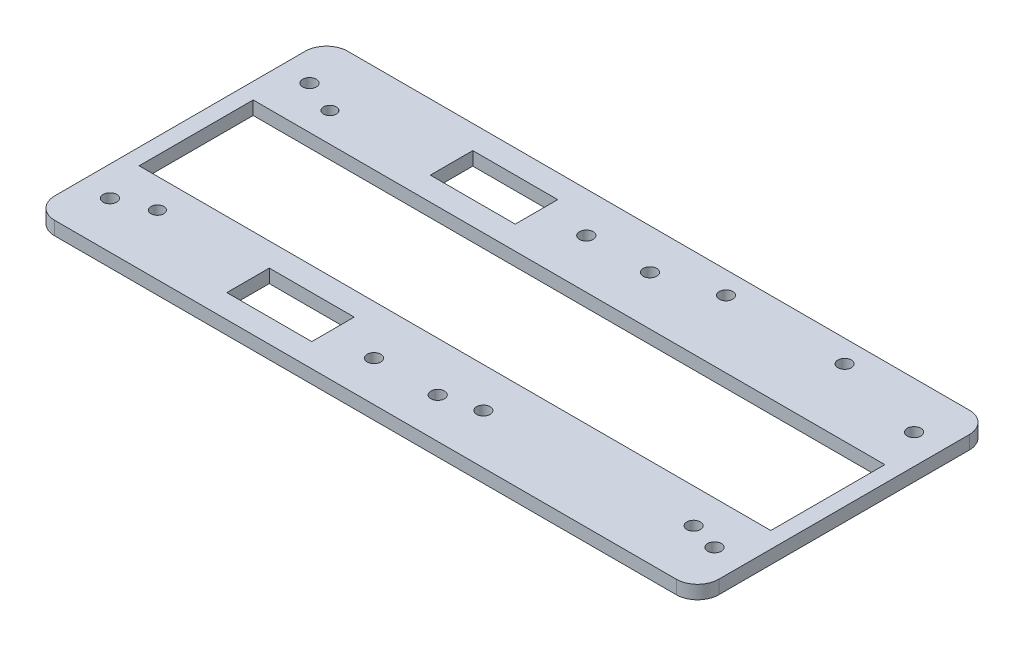
from build123d import *

# Parameters (mm, degrees)
SKETCH2_W           = 156.4
SKETCH2_H           = 69
BOSS_EXTRUDE1_DEPTH = 3.175
SKETCH4_R           = 1.6
CUT_EXTRUDE1_DEPTH  = 86.531109107
SKETCH6_R           = 1.5875
CUT_EXTRUDE2_DEPTH  = 86.531109107
SKETCH7_R           = 1.5
CUT_EXTRUDE3_DEPTH  = 86.531109107
SKETCH8_W           = 146.78
SKETCH8_H           = 24.86
CUT_EXTRUDE4_DEPTH  = 86.531109107
SKETCH10_R          = 1.6
CUT_EXTRUDE6_DEPTH  = 86.531109107
SKETCH11_W          = 148.78
SKETCH11_H          = 26.86
CUT_EXTRUDE7_DEPTH  = 86.531109107
SKETCH12_W          = 20
SKETCH12_H          = 10
CUT_EXTRUDE8_DEPTH  = 86.531109107
FILLET1_R           = 5


with BuildPart() as part:
    # Sketch2 → Boss-Extrude1 (new body)
    with BuildSketch(Plane(origin=(0, 0, 0), x_dir=(1, 0, 0), z_dir=(0, 1, 0))):
        Rectangle(SKETCH2_W, SKETCH2_H)
    extrude(amount=BOSS_EXTRUDE1_DEPTH)

    # Sketch4 → Cut-Extrude1 (cut, through all)
    with BuildSketch(Plane(origin=(0, 3.175, 0), x_dir=(1, 0, 0), z_dir=(0, 1, 0))):
        with Locations(Location((71.2, -23.5, 0), (0, 0, 270))):
            Circle(SKETCH4_R)
        with Locations(Location((71.2, 23.5, 0), (0, 0, 90))):
            Circle(SKETCH4_R)
        with Locations(Location((-71.2, 23.5, 0), (0, 0, 270))):
            Circle(SKETCH4_R)
        with Locations(Location((-71.2, -23.5, 0), (0, 0, 90))):
            Circle(SKETCH4_R)
    extrude(amount=-CUT_EXTRUDE1_DEPTH, mode=Mode.SUBTRACT)

    # Sketch6 → Cut-Extrude2 (cut, through all)
    with BuildSketch(Plane.XZ):
        with Locations(Location((49.09, -29.25, 0), (0, 0, 270))):
            Circle(SKETCH6_R)
        with Locations(Location((21.15, -29.25, 0), (0, 0, 270))):
            Circle(SKETCH6_R)
        with Locations(Location((64.33, 21.55, 0), (0, 0, 270))):
            Circle(SKETCH6_R)
        with Locations(Location((16.07, 22.82, 0), (0, 0, 270))):
            Circle(SKETCH6_R)
    extrude(amount=-CUT_EXTRUDE2_DEPTH, mode=Mode.SUBTRACT)

    # Sketch7 → Cut-Extrude3 (cut, through all)
    with BuildSketch(Plane(origin=(0, 0, 0), x_dir=(-1, 0, 0), z_dir=(0, -1, 0))):
        with Locations(Location((63.2, -20.32, 0), (0, 0, 90))):
            Circle(SKETCH7_R)
        with Locations(Location((63.2, 20.32, 0), (0, 0, 270))):
            Circle(SKETCH7_R)
    extrude(amount=-CUT_EXTRUDE3_DEPTH, mode=Mode.SUBTRACT)

    # Sketch8 → Cut-Extrude4 (cut, through all)
    with BuildSketch(Plane.XZ):
        Rectangle(SKETCH8_W, SKETCH8_H)
    extrude(amount=-CUT_EXTRUDE4_DEPTH, mode=Mode.SUBTRACT)

    # Sketch10 → Cut-Extrude6 (cut, through all)
    with BuildSketch(Plane(origin=(0, 3.175, 0), x_dir=(1, 0, 0), z_dir=(0, 1, 0))):
        with Locations(Location((-7.5, -25, 0), (0, 0, 270))):
            Circle(SKETCH10_R)
        with Locations(Location((7.5, -25, 0), (0, 0, 270))):
            Circle(SKETCH10_R)
        with Locations(Location((7.5, 25, 0), (0, 0, 270))):
            Circle(SKETCH10_R)
        with Locations(Location((-7.5, 25, 0), (0, 0, 270))):
            Circle(SKETCH10_R)
    extrude(amount=-CUT_EXTRUDE6_DEPTH, mode=Mode.SUBTRACT)

    # Sketch11 → Cut-Extrude7 (cut, through all)
    with BuildSketch(Plane.XZ):
        Rectangle(SKETCH11_W, SKETCH11_H)
    extrude(amount=-CUT_EXTRUDE7_DEPTH, mode=Mode.SUBTRACT)

    # Sketch12 → Cut-Extrude8 (cut, through all)
    with BuildSketch(Plane.XZ):
        with Locations((-28.2, -23.965)):
            Rectangle(SKETCH12_W, SKETCH12_H)
        with Locations((-28.2, 23.965)):
            Rectangle(SKETCH12_W, SKETCH12_H)
    extrude(amount=-CUT_EXTRUDE8_DEPTH, mode=Mode.SUBTRACT)

    # Fillet1
    fillet1_edges = [part.edges().sort_by_distance(p)[0] for p in [
        (78.2, 1.5875, 34.5),
        (-78.2, 1.5875, 34.5),
        (-78.2, 1.5875, -34.5),
        (78.2, 1.5875, -34.5),
    ]]
    fillet(fillet1_edges, radius=FILLET1_R)


solid = part.part
